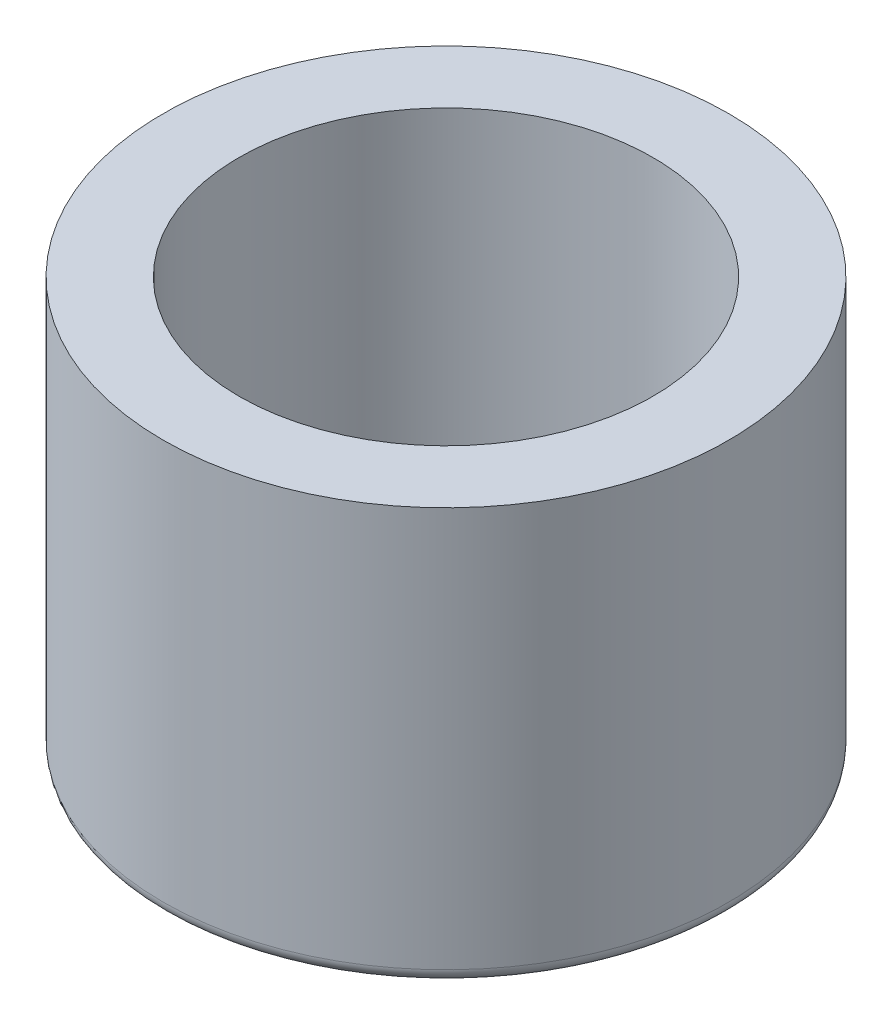
from build123d import *

# Parameters (mm, degrees)
SKETCH1_R           = 10.25
BOSS_EXTRUDE1_DEPTH = 15
SKETCH2_R           = 7.5
CUT_EXTRUDE1_DEPTH  = 15
FILLET1_R           = 0.5


with BuildPart() as part:
    # Sketch1 → Boss-Extrude1 (new body)
    with BuildSketch(Plane(origin=(0, 0, 0), x_dir=(1, 0, 0), z_dir=(0, 1, 0))):
        with Locations(Location((0, 0, 0), (0, 0, 270))):
            Circle(SKETCH1_R)
    extrude(amount=BOSS_EXTRUDE1_DEPTH)

    # Sketch2 → Cut-Extrude1 (cut)
    with BuildSketch(Plane(origin=(0, 15, 0), x_dir=(1, 0, 0), z_dir=(0, 1, 0))):
        with Locations(Location((0, 0, 0), (0, 0, 270))):
            Circle(SKETCH2_R)
    extrude(amount=-CUT_EXTRUDE1_DEPTH, mode=Mode.SUBTRACT)

    # Fillet1
    fillet1_edges = [part.edges().sort_by_distance(p)[0] for p in [
        (0, 0, -10.25),
    ]]
    fillet(fillet1_edges, radius=FILLET1_R)


solid = part.part
